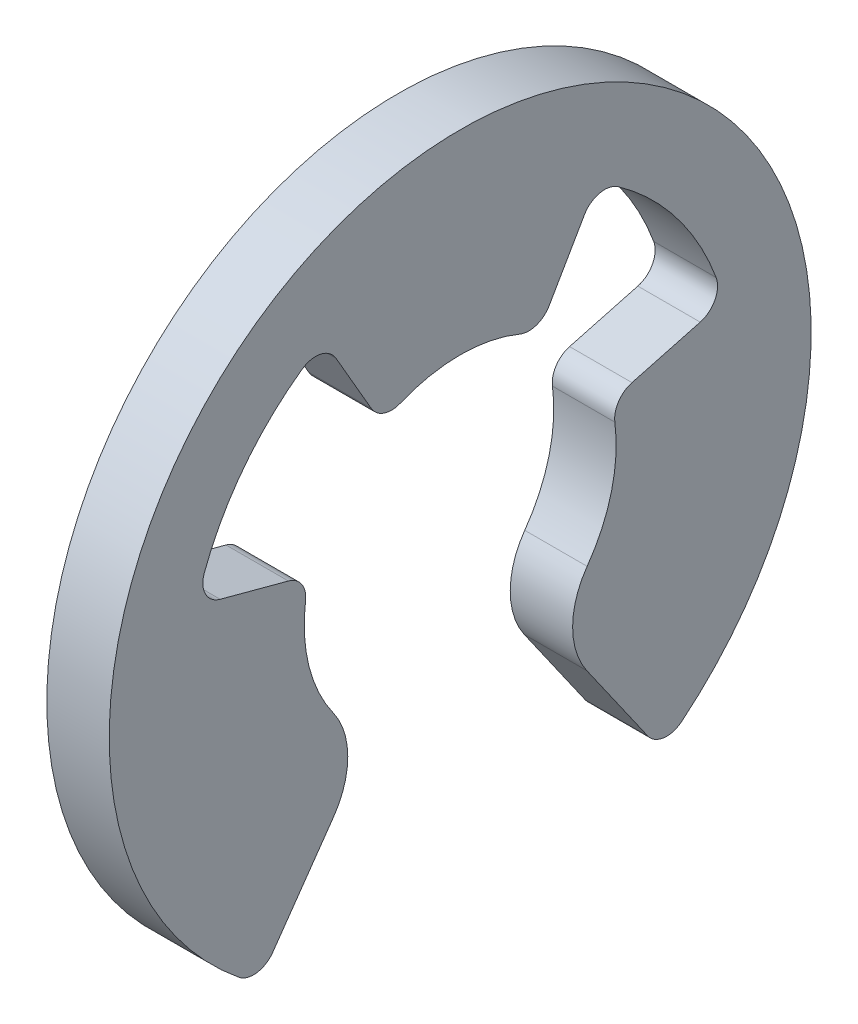
from build123d import *

# Parameters (mm, degrees)
EXTRUDE_1_DEPTH = 0.8


with BuildPart() as part:
    # 草图1 → 凸台-拉伸1 (new body)
    with BuildSketch(Plane(origin=(0, 0, 0), x_dir=(0, 0, -1), z_dir=(1, 0, 0))):
        with BuildLine():
            Line((-1.622319151, -2.316911861), (-2.402867712, -3.431650734))
            ThreePointArc((-2.402867712, -3.431650734), (-2.607110405, -3.556693113), (-2.837799992, -3.492404789))
            ThreePointArc((-2.837799992, -3.492404789), (0, 4.5), (2.837799992, -3.492404789))
            ThreePointArc((2.837799992, -3.492404789), (2.607110405, -3.556693113), (2.402867712, -3.431650734))
            Line((2.402867712, -3.431650734), (1.622319151, -2.316911861))
            ThreePointArc((1.622319151, -2.316911861), (1.441481842, -1.738720971), (1.627647463, -1.162223617))
            ThreePointArc((1.627647463, -1.162223617), (1.9404922, -0.484241696), (1.982865646, 0.261235201))
            ThreePointArc((1.982865646, 0.261235201), (2.030846926, 0.467080052), (2.202649779, 0.59019823))
            Line((2.202649779, 0.59019823), (3.077349334, 0.824573269))
            ThreePointArc((3.077349334, 0.824573269), (3.266264026, 0.97670818), (3.280925835, 1.218821425))
            ThreePointArc((3.280925835, 1.218821425), (2.776736691, 2.130665002), (2.026457183, 2.853676801))
            ThreePointArc((2.026457183, 2.853676801), (1.788798992, 2.902178099), (1.592953232, 2.759075932))
            Line((1.592953232, 2.759075932), (1.140175425, 1.974841766))
            ThreePointArc((1.140175425, 1.974841766), (0.976786548, 1.840758282), (0.765537221, 1.847688492))
            ThreePointArc((0.765537221, 1.847688492), (0, 2), (-0.765537221, 1.847688492))
            ThreePointArc((-0.765537221, 1.847688492), (-0.976786548, 1.840758282), (-1.140175425, 1.974841766))
            Line((-1.140175425, 1.974841766), (-1.592953232, 2.759075932))
            ThreePointArc((-1.592953232, 2.759075932), (-1.788798992, 2.902178099), (-2.026457183, 2.853676801))
            ThreePointArc((-2.026457183, 2.853676801), (-2.776736691, 2.130665002), (-3.280925835, 1.218821425))
            ThreePointArc((-3.280925835, 1.218821425), (-3.266264026, 0.97670818), (-3.077349334, 0.824573269))
            Line((-3.077349334, 0.824573269), (-2.202649779, 0.59019823))
            ThreePointArc((-2.202649779, 0.59019823), (-2.030846926, 0.467080052), (-1.982865646, 0.261235201))
            ThreePointArc((-1.982865646, 0.261235201), (-1.9404922, -0.484241696), (-1.627647463, -1.162223617))
            ThreePointArc((-1.627647463, -1.162223617), (-1.441481842, -1.738720971), (-1.622319151, -2.316911861))
        make_face()
    extrude(amount=EXTRUDE_1_DEPTH)


solid = part.part
